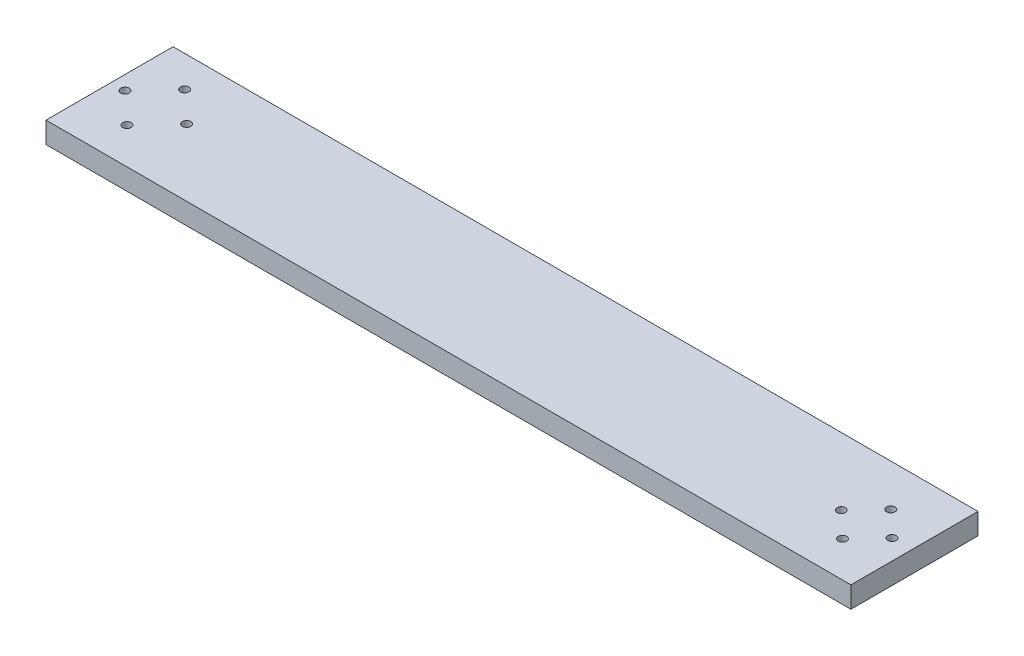
from build123d import *

# Parameters (mm, degrees)
SKETCH1_W           = 190
SKETCH1_H           = 30
BOSS_EXTRUDE6_DEPTH = 5
SKETCH5_R           = 1
CUT_EXTRUDE1_DEPTH  = 5


with BuildPart() as part:
    # Sketch1 → Boss-Extrude6 (new body)
    with BuildSketch(Plane(origin=(0, 0, 0), x_dir=(1, 0, 0), z_dir=(0, 1, 0))):
        with Locations((95, 15)):
            Rectangle(SKETCH1_W, SKETCH1_H)
    extrude(amount=BOSS_EXTRUDE6_DEPTH)

    # Sketch5 → Cut-Extrude1 (cut)
    with BuildSketch(Plane(origin=(0, 5, 0), x_dir=(1, 0, 0), z_dir=(0, 1, 0))):
        with Locations(Location((185.293524886, 14.421195353, 0), (0, 0, 270))):
            Circle(SKETCH5_R)
        with Locations(Location((179.593429878, 8.425036842, 0), (0, 0, 270))):
            Circle(SKETCH5_R)
        with Locations(Location((173.597271366, 14.125131851, 0), (0, 0, 270))):
            Circle(SKETCH5_R)
        with Locations(Location((179.297366375, 20.121290362, 0), (0, 0, 270))):
            Circle(SKETCH5_R)
        with Locations(Location((3.28530035, 15.341967946, 0), (0, 0, 270))):
            Circle(SKETCH5_R)
        with Locations(Location((10.101910635, 22.625655016, 0), (0, 0, 270))):
            Circle(SKETCH5_R)
        with Locations(Location((17.385597705, 15.809044731, 0), (0, 0, 270))):
            Circle(SKETCH5_R)
        with Locations(Location((10.56898742, 8.525357661, 0), (0, 0, 270))):
            Circle(SKETCH5_R)
    extrude(amount=-CUT_EXTRUDE1_DEPTH, mode=Mode.SUBTRACT)


solid = part.part
